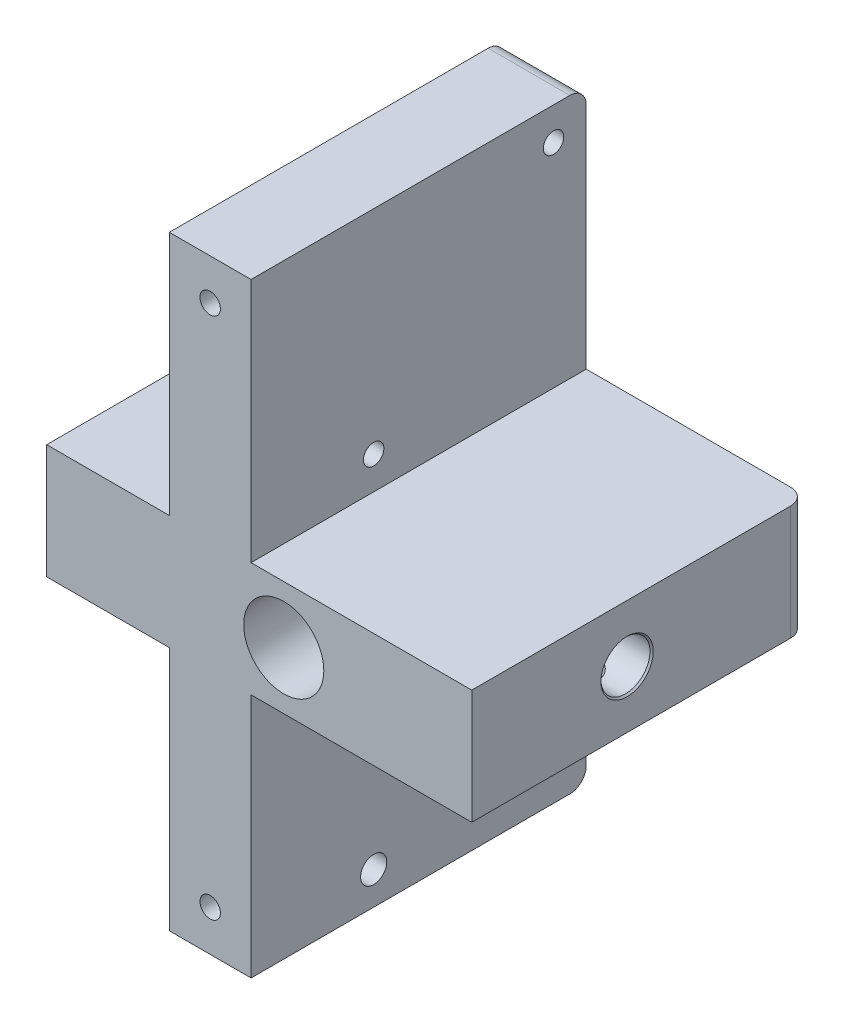
from build123d import *

# Parameters (mm, degrees)
BOSS_EXTRU_1_DEPTH                = 19
BOSS_EXTRU_1_DEPTH_BACK           = 22
ESQUISSE1_R                       = 4.9
DIAM_TRE_DU_PER_AGE_6_0_6_1_D     = 6
DIAM_TRE_DU_PER_AGE_6_0_6_1_DEPTH = 10
DIAM_TRE_DU_PER_AGE_6_0_6_1_TIP   = 1.802581857
ENL_V_MAT_EXTRU_1_REACH           = 52.813
ESQUISSE6_R                       = 1.6
DIAM_TRE_DU_PER_AGE_3_0_3_1_D     = 3
DIAM_TRE_DU_PER_AGE_3_0_3_1_DEPTH = 10
DIAM_TRE_DU_PER_AGE_3_0_3_1_TIP   = 0.901290929
TROU_TARAUD_M31_D                 = 2.5
TROU_TARAUD_M31_DEPTH             = 8.5
TROU_TARAUD_M31_TIP               = 0.751075774
CONG_1_R                          = 2
TROU_TARAUD_M32_REACH             = 59.105
TROU_TARAUD_M32_BORE_R            = 1.25
TROU_TARAUD_M41_REACH             = 59.105
TROU_TARAUD_M41_BORE_R            = 1.65
CHANFREIN1_SIZE                   = 0.2
TROU_TARAUD_M33_D                 = 2.5


with BuildPart() as part:
    # Esquisse1 → Boss.-Extru.1 (new, two sides: drawn at the far end of the back side and taken through both)
    with BuildSketch(Plane.XY.offset(-BOSS_EXTRU_1_DEPTH_BACK)):
        Polygon((-4, -7), (-4, -37), (-14, -37), (-14, -7), (-29, -7), (-29, 7), (-14, 7), (-14, 37), (-4, 37), (-4, 7), (23, 7), (23, -7), align=None)
        Circle(ESQUISSE1_R, mode=Mode.SUBTRACT)
    extrude(amount=BOSS_EXTRU_1_DEPTH + BOSS_EXTRU_1_DEPTH_BACK)

    # Diamètre du perçage Ø6.0 (6)1
    with Locations(Plane(origin=(23, 0, 0), x_dir=(0, 0, -1), z_dir=(1, 0, 0))):
        with Locations((0, 0)):
            Hole(DIAM_TRE_DU_PER_AGE_6_0_6_1_D / 2, depth=DIAM_TRE_DU_PER_AGE_6_0_6_1_DEPTH)
            with Locations((0, 0, -(DIAM_TRE_DU_PER_AGE_6_0_6_1_DEPTH + DIAM_TRE_DU_PER_AGE_6_0_6_1_TIP / 2))):  # 118° drill point
                Cone(0, DIAM_TRE_DU_PER_AGE_6_0_6_1_D / 2, DIAM_TRE_DU_PER_AGE_6_0_6_1_TIP, mode=Mode.SUBTRACT)

    # Esquisse6 → Enlèv. mat.-Extru.1 (cut, up to next)
    with BuildSketch(Plane(origin=(-4, 0, 0), x_dir=(0, 0, -1), z_dir=(1, 0, 0)), mode=Mode.PRIVATE) as enl_v_mat_extru_1_sk1:
        with Locations(Location((18, -11, 0), (0, 0, 90))):
            Circle(ESQUISSE6_R)
    enl_v_mat_extru_1_tool1 = extrude(enl_v_mat_extru_1_sk1.sketch, amount=-ENL_V_MAT_EXTRU_1_REACH, mode=Mode.PRIVATE) & part.part
    # Esquisse6 → Enlèv. mat.-Extru.1 (cut, up to next)
    with BuildSketch(Plane(origin=(-4, 0, 0), x_dir=(0, 0, -1), z_dir=(1, 0, 0)), mode=Mode.PRIVATE) as enl_v_mat_extru_1_sk2:
        with Locations(Location((-4, -33, 0), (0, 0, 90))):
            Circle(ESQUISSE6_R)
    enl_v_mat_extru_1_tool2 = extrude(enl_v_mat_extru_1_sk2.sketch, amount=-ENL_V_MAT_EXTRU_1_REACH, mode=Mode.PRIVATE) & part.part
    add(enl_v_mat_extru_1_tool1.solids().sort_by_distance((-4, -11, -18))[0], mode=Mode.SUBTRACT)
    add(enl_v_mat_extru_1_tool2.solids().sort_by_distance((-4, -33, 4))[0], mode=Mode.SUBTRACT)

    # Diamètre du perçage Ø3.0 (3)1
    with Locations(Plane.ZY.offset(29)):
        with Locations((0, 0)):
            Hole(DIAM_TRE_DU_PER_AGE_3_0_3_1_D / 2, depth=DIAM_TRE_DU_PER_AGE_3_0_3_1_DEPTH)
            with Locations((0, 0, -(DIAM_TRE_DU_PER_AGE_3_0_3_1_DEPTH + DIAM_TRE_DU_PER_AGE_3_0_3_1_TIP / 2))):  # 118° drill point
                Cone(0, DIAM_TRE_DU_PER_AGE_3_0_3_1_D / 2, DIAM_TRE_DU_PER_AGE_3_0_3_1_TIP, mode=Mode.SUBTRACT)

    # Trou taraudé M31
    with Locations(Plane.XY.offset(19)):
        with Locations((-9, 32), (-9, -32)):
            Hole(TROU_TARAUD_M31_D / 2, depth=TROU_TARAUD_M31_DEPTH)
            with Locations((0, 0, -(TROU_TARAUD_M31_DEPTH + TROU_TARAUD_M31_TIP / 2))):  # 118° drill point
                Cone(0, TROU_TARAUD_M31_D / 2, TROU_TARAUD_M31_TIP, mode=Mode.SUBTRACT)

    # Congé1
    cong_1_edges = [part.edges().sort_by_distance(p)[0] for p in [
        (-29, 0, -22),
        (-9, -37, -22),
        (23, 0, -22),
        (-9, 37, -22),
    ]]
    fillet(cong_1_edges, radius=CONG_1_R)

    # Trou taraudé M32 bore → Trou taraudé M32 (cut, up to next)
    with BuildSketch(Plane(origin=(0, -7, 0), x_dir=(-1, 0, 0), z_dir=(0, -1, 0)), mode=Mode.PRIVATE) as trou_taraud_m32_sk1:
        with Locations((25, 0)):
            Circle(TROU_TARAUD_M32_BORE_R)
    trou_taraud_m32_tool1 = extrude(trou_taraud_m32_sk1.sketch, amount=-TROU_TARAUD_M32_REACH, mode=Mode.PRIVATE) & part.part
    # Trou taraudé M32 bore → Trou taraudé M32 (cut, up to next)
    with BuildSketch(Plane(origin=(0, -7, 0), x_dir=(-1, 0, 0), z_dir=(0, -1, 0)), mode=Mode.PRIVATE) as trou_taraud_m32_sk2:
        with Locations((0, -11)):
            Circle(TROU_TARAUD_M32_BORE_R)
    trou_taraud_m32_tool2 = extrude(trou_taraud_m32_sk2.sketch, amount=-TROU_TARAUD_M32_REACH, mode=Mode.PRIVATE) & part.part
    add(trou_taraud_m32_tool1.solids().sort_by_distance((-25, -7, 0))[0], mode=Mode.SUBTRACT)
    add(trou_taraud_m32_tool2.solids().sort_by_distance((0, -7, 11))[0], mode=Mode.SUBTRACT)

    # Trou taraudé M41 bore → Trou taraudé M41 (cut, up to next)
    with BuildSketch(Plane(origin=(0, -7, 0), x_dir=(-1, 0, 0), z_dir=(0, -1, 0)), mode=Mode.PRIVATE) as trou_taraud_m41_sk1:
        with Locations((-18, 0)):
            Circle(TROU_TARAUD_M41_BORE_R)
    trou_taraud_m41_tool1 = extrude(trou_taraud_m41_sk1.sketch, amount=-TROU_TARAUD_M41_REACH, mode=Mode.PRIVATE) & part.part
    add(trou_taraud_m41_tool1.solids().sort_by_distance((18, -7, 0))[0], mode=Mode.SUBTRACT)

    # Chanfrein1
    chanfrein1_edges = [part.edges().sort_by_distance(p)[0] for p in [
        (-4.9, 0, -22),
        (23, 0, -3),
        (-29, 0, 1.5),
    ]]
    chamfer(chanfrein1_edges, length=CHANFREIN1_SIZE)

    # Trou taraudé M33 (through all)
    with Locations(Plane(origin=(-4, 0, 0), x_dir=(0, 0, -1), z_dir=(1, 0, 0))):
        with Locations((18, 33), (-4, 11)):
            Hole(TROU_TARAUD_M33_D / 2)


solid = part.part
